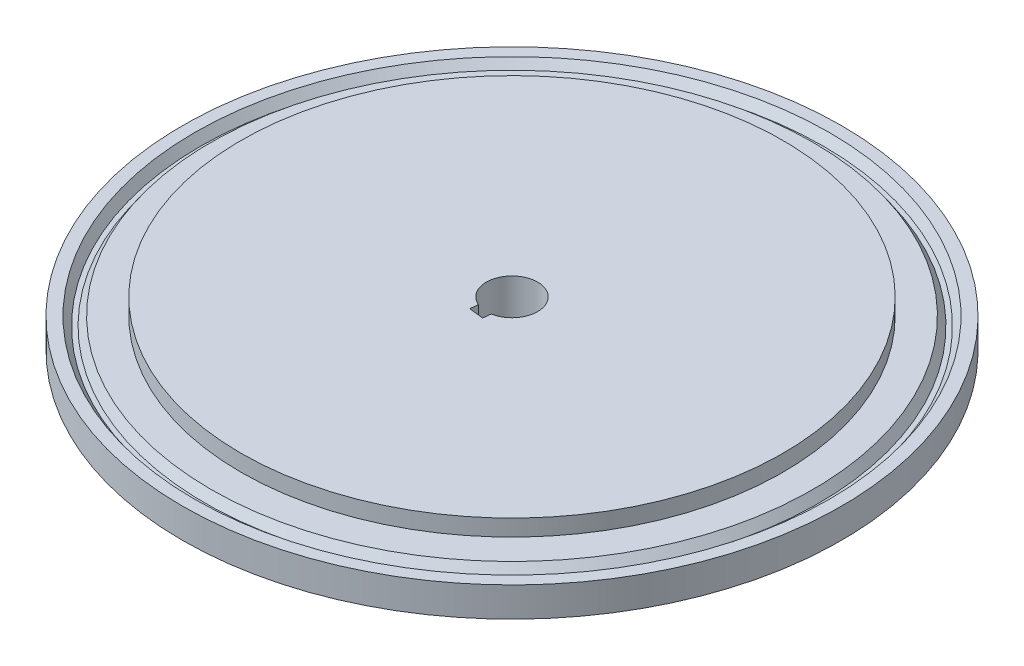
from build123d import *

# Parameters (mm, degrees)
SKETCH_1_R          = 90
EXTRUDE_1_DEPTH     = 12.6
CUT_EXTRUDE_2_DEPTH = 32
SKETCH_12_R         = 90.5
SKETCH_12_R_2       = 74
CUT_EXTRUDE_3_DEPTH = 4.5


with BuildPart() as part:
    # Эскиз1 → Вытянуть1 (new body)
    with BuildSketch(Plane(origin=(0, 0, 0), x_dir=(1, 0, 0), z_dir=(0, 1, 0))):
        with Locations(Location((0, 0, 0), (0, 0, 270))):
            Circle(SKETCH_1_R)
    extrude(amount=EXTRUDE_1_DEPTH)

    # Эскиз3 → Вырез-Вытянуть2 (cut)
    with BuildSketch(Plane.XZ):
        with BuildLine():
            Line((-2.741099481, 6.440991666), (-2.981761783, 8.569223808))
            Line((-2.981761783, 8.569223808), (0.992906346, 9.018682664))
            Line((0.992906346, 9.018682664), (1.233568648, 6.890450522))
            ThreePointArc((1.233568648, 6.890450522), (0.786552998, -6.955669226), (-2.741099481, 6.440991666))
        make_face()
    extrude(amount=-CUT_EXTRUDE_2_DEPTH, mode=Mode.SUBTRACT)

    # Эскиз4 → Вырез-Повернуть1 (revolve, cut)
    with BuildSketch(Plane.XY, mode=Mode.PRIVATE) as cut_revolve_1_sk:
        Polygon((68.863884992, 5.478404134), (72.400551948, 5.478404134), (77.896748421, -0.267847705), (63.367688519, -0.267847705), align=None)
    revolve(cut_revolve_1_sk.sketch.rotate(Axis((0, 80, 0), (0, 1, 0)), 270), axis=Axis((0, 80, 0), (0, 1, 0)), mode=Mode.SUBTRACT)

    # Эскиз7 → Вырез-Повернуть2 (revolve, cut)
    with BuildSketch(Plane.XY, mode=Mode.PRIVATE) as cut_revolve_2_sk:
        Polygon((85.06284255, 5.700411661), (87.617091847, 9.423063388), (81.248665283, 9.423063388), (83.802914581, 5.700411661), align=None)
    revolve(cut_revolve_2_sk.sketch.rotate(Axis((0, 0, 0), (0, 1, 0)), 90), axis=Axis((0, 0, 0), (0, 1, 0)), mode=Mode.SUBTRACT)

    # Эскиз12 → Вытянуть3 (cut)
    with BuildSketch(Plane(origin=(0, 12.6, 0), x_dir=(1, 0, 0), z_dir=(0, 1, 0))):
        Circle(SKETCH_12_R)
        with Locations(Location((0, 0, 0), (0, 0, 270))):
            Circle(SKETCH_12_R_2, mode=Mode.SUBTRACT)
    extrude(amount=-CUT_EXTRUDE_3_DEPTH, mode=Mode.SUBTRACT)


solid = part.part
